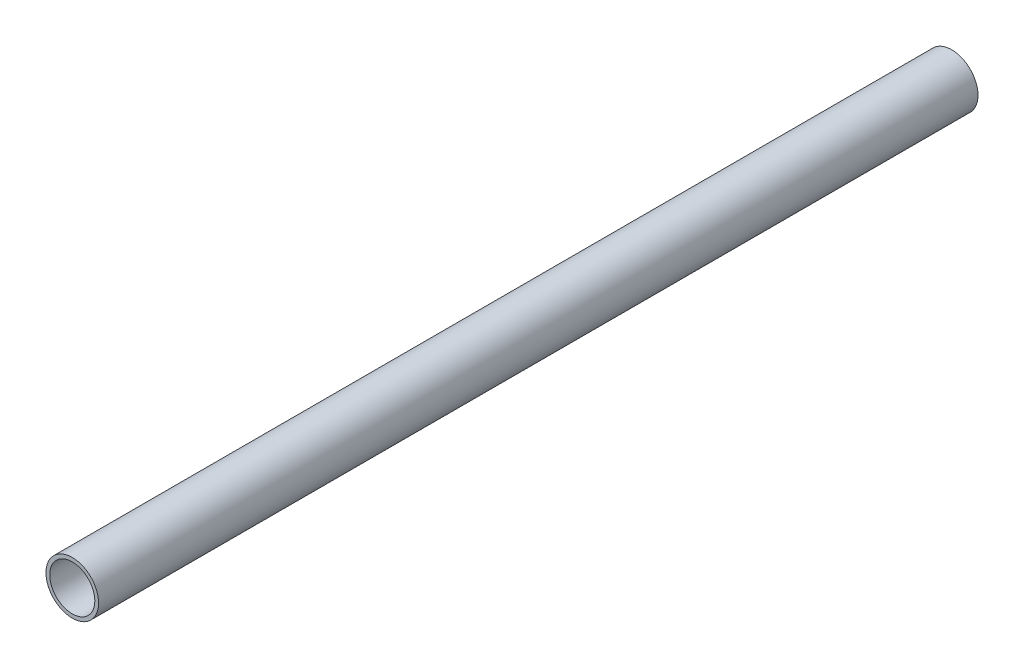
from build123d import *

# Parameters (mm, degrees)
ARM_CROSS_SECTION_SKETCH_R   = 7
ARM_CROSS_SECTION_SKETCH_R_2 = 6
ARM_EXTRUDE_DEPTH            = 234


with BuildPart() as part:
    # Arm Cross-Section Sketch → Arm Extrude (new body)
    with BuildSketch(Plane.XY):
        Circle(ARM_CROSS_SECTION_SKETCH_R)
        Circle(ARM_CROSS_SECTION_SKETCH_R_2, mode=Mode.SUBTRACT)
    extrude(amount=ARM_EXTRUDE_DEPTH)


solid = part.part
